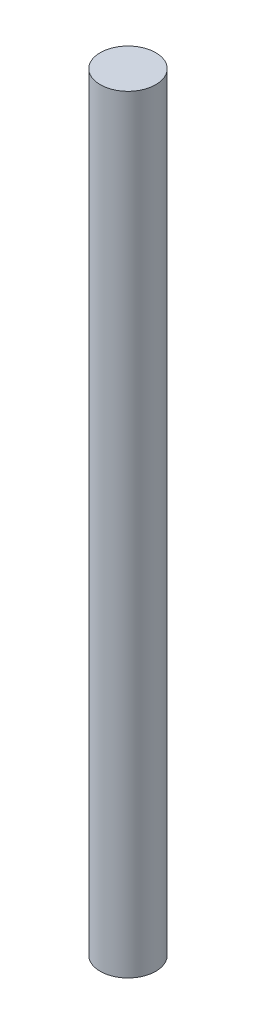
from build123d import *

# Parameters (mm, degrees)
SKETCH1_R           = 3
BOSS_EXTRUDE1_DEPTH = 83


with BuildPart() as part:
    # Sketch1 → Boss-Extrude1 (new body)
    with BuildSketch(Plane(origin=(0, 0, 0), x_dir=(1, 0, 0), z_dir=(0, 1, 0))):
        with Locations(Location((0, 0, 0), (0, 0, 270))):
            Circle(SKETCH1_R)
    extrude(amount=BOSS_EXTRUDE1_DEPTH)


solid = part.part
